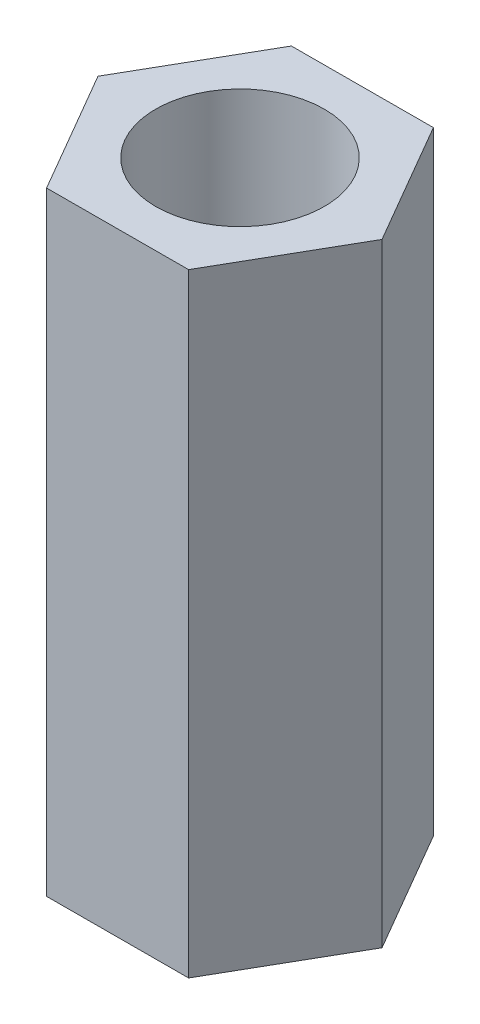
from build123d import *

# Parameters (mm, degrees)
EXTRUDE_1_DEPTH     = 10
SKETCH_2_R          = 1.375
CUT_EXTRUDE_1_DEPTH = 10


with BuildPart() as part:
    # 草图1 → 凸台-拉伸1 (new body)
    with BuildSketch(Plane(origin=(0, 0, 0), x_dir=(1, 0, 0), z_dir=(0, 1, 0))):
        Polygon((1.159632305, -1.997144524), (2.309394045, 0.005698773), (1.149761741, 2.002843297), (-1.159632305, 1.997144524), (-2.309394045, -0.005698773), (-1.149761741, -2.002843297), align=None)
    extrude(amount=EXTRUDE_1_DEPTH)

    # 草图2 → 切除-拉伸1 (cut)
    with BuildSketch(Plane(origin=(0, 0, 0), x_dir=(1, 0, 0), z_dir=(0, 1, 0))):
        with Locations(Location((0, 0, 0), (0, 0, 270))):
            Circle(SKETCH_2_R)
    extrude(amount=CUT_EXTRUDE_1_DEPTH, mode=Mode.SUBTRACT)


solid = part.part
